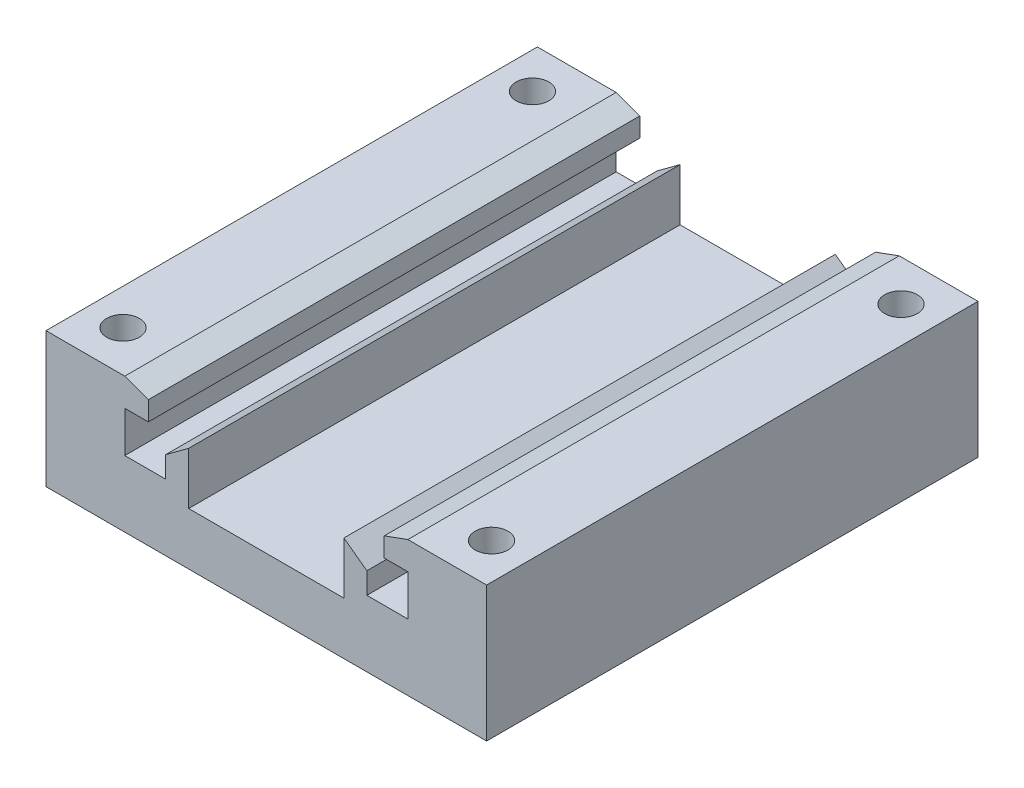
from build123d import *

# Parameters (mm, degrees)
BOSS_EXTRUDE1_DEPTH             = 60
F_4_0MM_DOWEL_HOLE1_D           = 4
F_4_0MM_DOWEL_HOLE1_CSINK_D     = 4.05
F_4_0MM_DOWEL_HOLE1_CSINK_ANGLE = 90


with BuildPart() as part:
    # Sketch2 → Boss-Extrude1 (new body)
    with BuildSketch(Plane.XY):
        Polygon((36.38, 6.4), (26.9, 6.4), (26.9, 0), (53.8, 0), (53.8, 16.5), (44.18, 16.5), (41.3, 15.451765725), (41.3, 13.1), (44.18, 13.1), (44.18, 8.1), (39.18, 8.1), (39.18, 10.7), (36.38, 12.766601886), align=None)
    boss_extrude1 = extrude(amount=-BOSS_EXTRUDE1_DEPTH)

    # Mirror1: Boss-Extrude1 across plane
    add(boss_extrude1.mirror(Plane(origin=(26.9, 0, -60), x_dir=(0, 0, 1), z_dir=(1, 0, 0))))

    # Ø4.0mm Dowel Hole1 (through all)
    with Locations(Plane(origin=(0, 0, 0), x_dir=(-1, 0, 0), z_dir=(0, -1, 0))):
        with Locations((-49.4, 55), (-4.4, 55), (-4.4, 5), (-49.4, 5)):
            CounterSinkHole(F_4_0MM_DOWEL_HOLE1_D / 2, F_4_0MM_DOWEL_HOLE1_CSINK_D / 2, counter_sink_angle=F_4_0MM_DOWEL_HOLE1_CSINK_ANGLE)


solid = part.part
